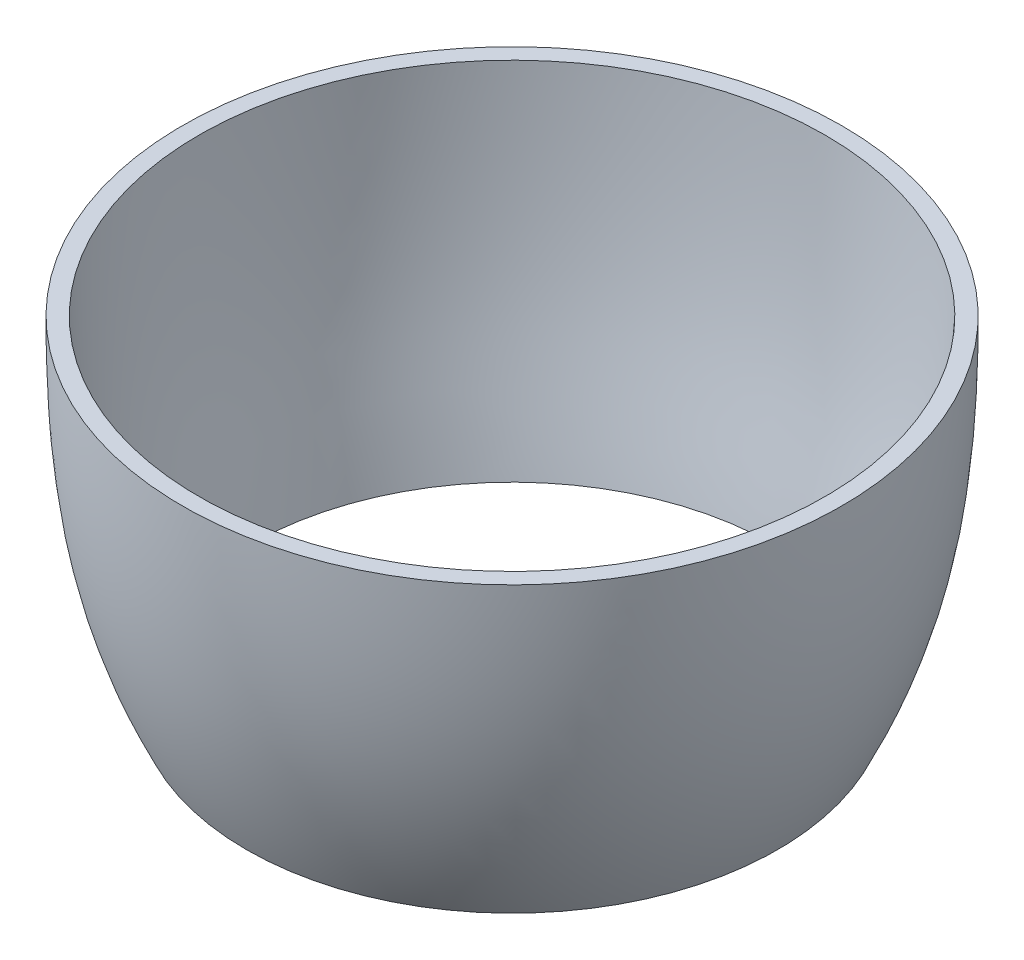
from build123d import *


with BuildPart() as part:
    # Sketch2 → Revolve1 (revolve)
    with BuildSketch(Plane(origin=(0, 0, 0), x_dir=(0, 0, -1), z_dir=(1, 0, 0))):
        with BuildLine():
            Line((25.4, 25.4), (24.13, 25.4))
            add(Edge.make_bspline(
                [(24.13, 25.4), (23.841101975, 20.362479875), (23.073197648, 11.776766009), (20.904209389, 3.458837223), (20.217810351, 0)],
                knots=[0, 0, 0, 0, 0.588812346, 1, 1, 1, 1], degree=3))
            Line((20.217810351, 0), (20.471810351, 0))
            add(Edge.make_bspline(
                [(25.4, 25.4), (25.400014218, 20.461634146), (24.982532369, 11.670463745), (22.113649649, 3.366656959), (20.471810351, 0)],
                knots=[0, 0, 0, 0, 0.569345297, 1, 1, 1, 1], degree=3))
        make_face()
    revolve(axis=Axis((0, 0, 0), (0, 1, 0)))


solid = part.part
